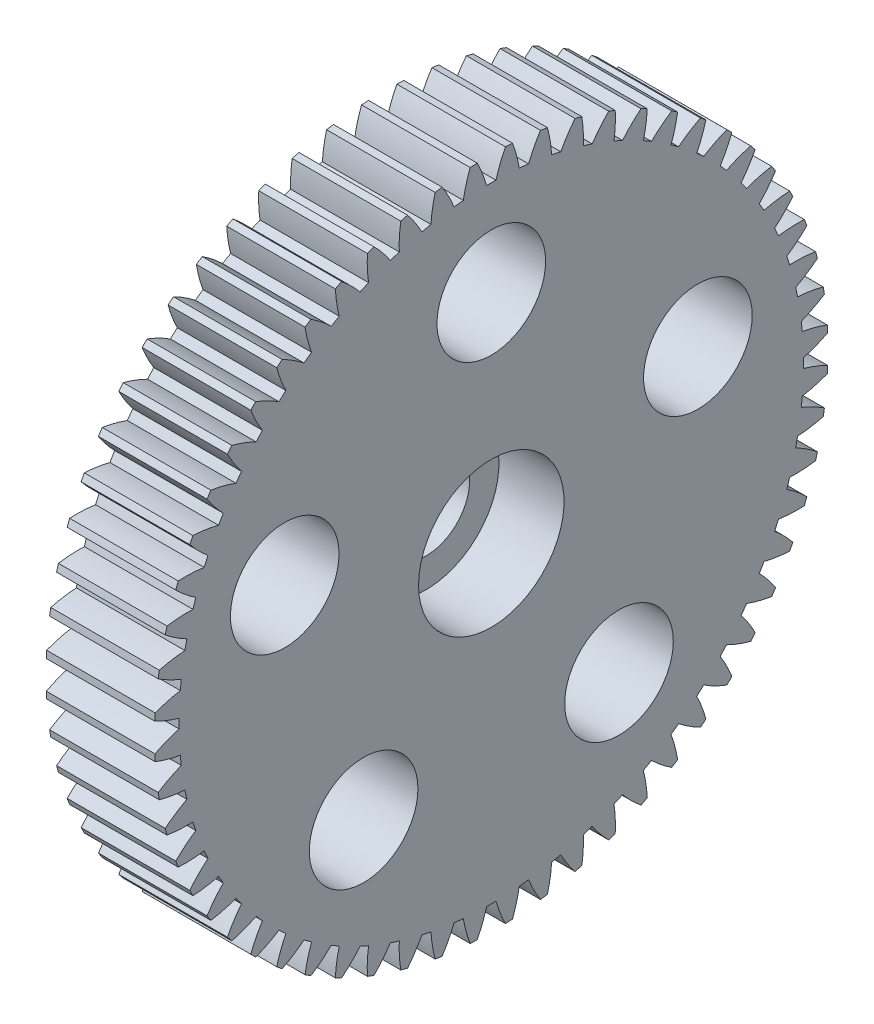
from build123d import *

# Parameters (mm, degrees)
BASPROSKE_W         = 10
BASPROSKE_H         = 31
TOOTHCUT_DEPTH      = 45.966654312
TEETHCUTS_COUNT     = 60
BORSKE_R            = 6.7
BORE_DEPTH          = 50.0000508
SKETCH_1_R          = 5
CUT_EXTRUDE_2_DEPTH = 10
EXTRUDE_START       = -4
SKETCH_3_R          = 6.7
SKETCH_3_R_2        = 4
EXTRUDE_2_DEPTH     = 4


with BuildPart() as part:
    # BasProSke → Base-Revolve (revolve)
    with BuildSketch(Plane(origin=(0, 0, 0), x_dir=(1, 0, 0), z_dir=(0, 1, 0)), mode=Mode.PRIVATE) as base_revolve_sk:
        with Locations((5, 15.5)):
            Rectangle(BASPROSKE_W, BASPROSKE_H)
    revolve(base_revolve_sk.sketch.rotate(Axis((-10, 0, 0), (1, 0, 0)), 180), axis=Axis((-10, 0, 0), (1, 0, 0)))

    # TooCutSke → ToothCut (cut, through all)
    with BuildSketch(Plane(origin=(0, 0, 0), x_dir=(0, 0, -1), z_dir=(1, 0, 0))):
        with BuildLine():
            ThreePointArc((0.430151971, 28.745781782), (0, 28.749), (-0.430151971, 28.745781782))
            ThreePointArc((-0.430151971, 28.745781782), (-0.81454129, 29.893990802), (-1.312684569, 30.997617721))
            ThreePointArc((-1.312684569, 30.997617721), (0, 31.0254), (1.312684569, 30.997617721))
            ThreePointArc((1.312684569, 30.997617721), (0.81454129, 29.893990802), (0.430151971, 28.745781782))
        make_face()
    toothcut = extrude(amount=TOOTHCUT_DEPTH, mode=Mode.SUBTRACT)

    # TeethCuts: ToothCut ×60 about axis
    teethcuts_axis = Axis((0, 0, 0), (1, 0, 0))
    for i in range(1, TEETHCUTS_COUNT):
        add(toothcut.rotate(teethcuts_axis, i * 360 / TEETHCUTS_COUNT), mode=Mode.SUBTRACT)

    # BorSke → Bore (cut, symmetric)
    with BuildSketch(Plane(origin=(0, 0, 0), x_dir=(0, 0, -1), z_dir=(1, 0, 0))):
        with Locations(Location((0, 0, 0), (0, 0, 180))):
            Circle(BORSKE_R)
    extrude(amount=BORE_DEPTH, both=True, mode=Mode.SUBTRACT)

    # 草图1 → 切除-拉伸2 (cut)
    with BuildSketch(Plane(origin=(10, 0, 0), x_dir=(0, 0, -1), z_dir=(1, 0, 0))):
        with Locations((0, 20)):
            Circle(SKETCH_1_R)
        with Locations((19.021130326, 6.180339887)):
            Circle(SKETCH_1_R)
        with Locations((11.755705046, -16.180339887)):
            Circle(SKETCH_1_R)
        with Locations((-11.755705046, -16.180339887)):
            Circle(SKETCH_1_R)
        with Locations((-19.021130326, 6.180339887)):
            Circle(SKETCH_1_R)
    extrude(amount=-CUT_EXTRUDE_2_DEPTH, mode=Mode.SUBTRACT)

    # 草图3 → 凸台-拉伸2 (add)
    with BuildSketch(Plane.ZY.offset(EXTRUDE_START)):
        Circle(SKETCH_3_R)
        Circle(SKETCH_3_R_2, mode=Mode.SUBTRACT)
    extrude(amount=EXTRUDE_2_DEPTH)


solid = part.part
